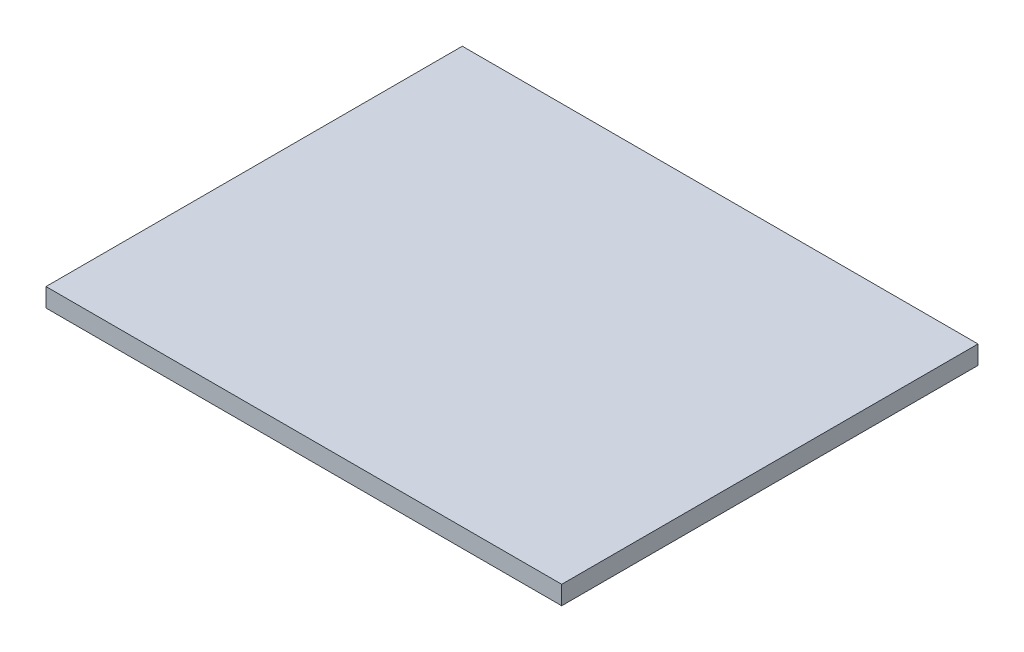
from build123d import *

# Parameters (mm, degrees)
SKETCH1_W           = 83
SKETCH1_H           = 67
BOSS_EXTRUDE1_DEPTH = 3


with BuildPart() as part:
    # Sketch1 → Boss-Extrude1 (new body)
    with BuildSketch(Plane(origin=(0, 0, 0), x_dir=(1, 0, 0), z_dir=(0, 1, 0))):
        with Locations((41.5, 33.5)):
            Rectangle(SKETCH1_W, SKETCH1_H)
    extrude(amount=BOSS_EXTRUDE1_DEPTH)


solid = part.part
